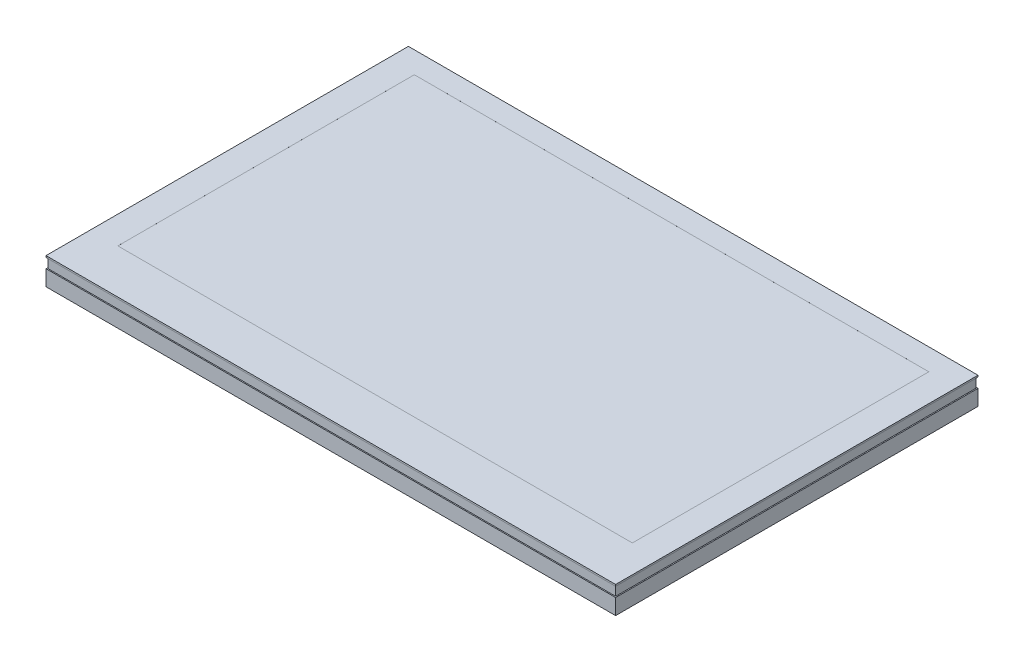
from build123d import *

# Parameters (mm, degrees)
SKETCH1_W           = 105.42
SKETCH1_H           = 67.07
BOSS_EXTRUDE1_DEPTH = 2.9
SKETCH2_W           = 105.02
SKETCH2_H           = 66.67
BOSS_EXTRUDE2_DEPTH = 1.8
SKETCH3_W           = 105.42
SKETCH3_H           = 67.07
BOSS_EXTRUDE3_DEPTH = 0.3
SKETCH4_W           = 105.42
SKETCH4_H           = 67.07
SKETCH4_W_2         = 95.22
SKETCH4_H_2         = 54.87
BOSS_EXTRUDE4_DEPTH = 0.001


with BuildPart() as part:
    # Sketch1 → Boss-Extrude1 (new body)
    with BuildSketch(Plane(origin=(0, 0, 0), x_dir=(1, 0, 0), z_dir=(0, 1, 0))):
        Rectangle(SKETCH1_W, SKETCH1_H)
    extrude(amount=BOSS_EXTRUDE1_DEPTH)


with BuildPart() as body_2:
    # Sketch2 → Boss-Extrude2 (new body)
    with BuildSketch(Plane(origin=(0, 2.9, 0), x_dir=(1, 0, 0), z_dir=(0, 1, 0))):
        Rectangle(SKETCH2_W, SKETCH2_H)
    extrude(amount=BOSS_EXTRUDE2_DEPTH)


with BuildPart() as body_3:
    # Sketch3 → Boss-Extrude3 (new body)
    with BuildSketch(Plane(origin=(0, 4.7, 0), x_dir=(1, 0, 0), z_dir=(0, 1, 0))):
        Rectangle(SKETCH3_W, SKETCH3_H)
    extrude(amount=BOSS_EXTRUDE3_DEPTH)


with BuildPart() as body_4:
    # Sketch4 → Boss-Extrude4 (new body)
    with BuildSketch(Plane(origin=(0, 5, 0), x_dir=(1, 0, 0), z_dir=(0, 1, 0))):
        Rectangle(SKETCH4_W, SKETCH4_H)
        with Locations((0, 2.1)):
            Rectangle(SKETCH4_W_2, SKETCH4_H_2, mode=Mode.SUBTRACT)
    extrude(amount=BOSS_EXTRUDE4_DEPTH)


solid = Compound([part.part, body_2.part, body_3.part, body_4.part])
